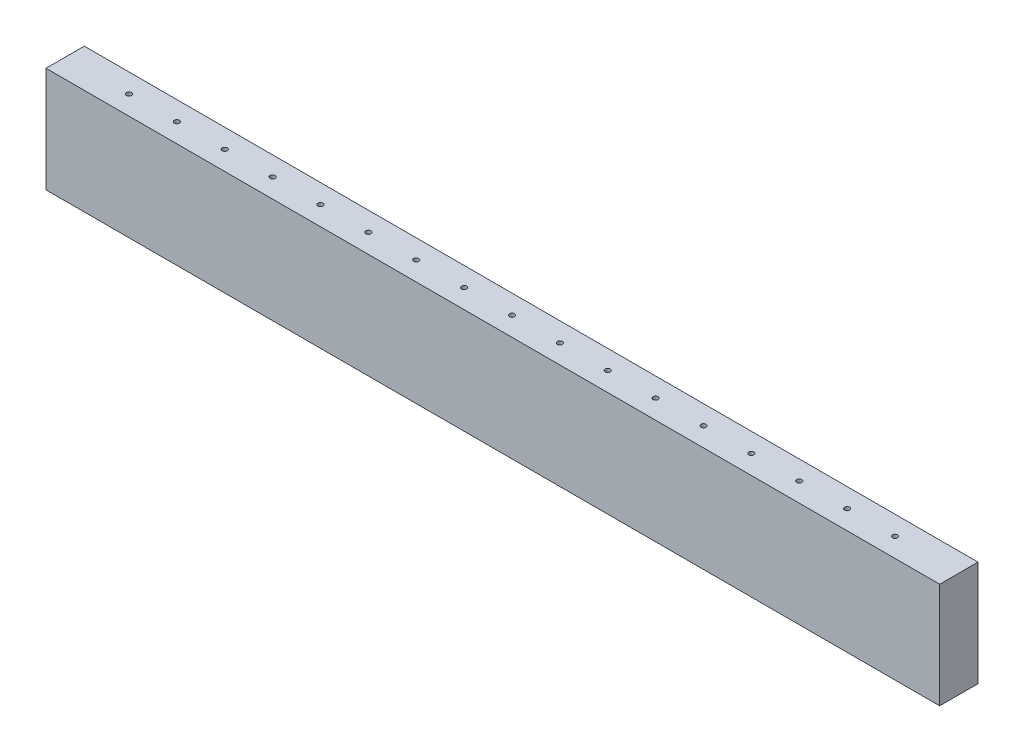
from build123d import *

# Parameters (mm, degrees)
SKETCH1_W             = 280
SKETCH1_H             = 12
BOSS_EXTRUDE1_DEPTH   = 33
LPATTERN1_COUNT       = 9
LPATTERN1_PITCH       = 15
LPATTERN1_COL_COUNT   = 9
LPATTERN1_COL_PITCH   = 15
M4_TAPPED_HOLE1_D     = 3.3
M4_TAPPED_HOLE1_DEPTH = 15
M4_TAPPED_HOLE1_TIP   = 0.991420021


with BuildPart() as part:
    # Sketch1 → Boss-Extrude1 (new body)
    with BuildSketch(Plane(origin=(0, 0, 0), x_dir=(1, 0, 0), z_dir=(0, 1, 0))):
        Rectangle(SKETCH1_W, SKETCH1_H)
    extrude(amount=BOSS_EXTRUDE1_DEPTH)

    # Sketch4 → M2 Tapped Hole1 (revolve, cut)
    with BuildSketch(Plane(origin=(0, 33, 0), x_dir=(0, 0, 1), z_dir=(1, 0, 0))):
        Polygon((0, 0), (0, 15.480688495), (0.8, 15), (0.8, 0), align=None)
    m2_tapped_hole1 = revolve(axis=Axis((0, 39.35, 0), (0, -1, 0)), mode=Mode.SUBTRACT)

    # LPattern1: M2 Tapped Hole1 ×9
    with Locations(*[(i * LPATTERN1_PITCH, 0, 0) for i in range(1, LPATTERN1_COUNT)]):
        add(m2_tapped_hole1, mode=Mode.SUBTRACT)

    # LPattern1 col: M2 Tapped Hole1 ×9
    with Locations(*[(-i * LPATTERN1_COL_PITCH, 0, 0) for i in range(1, LPATTERN1_COL_COUNT)]):
        add(m2_tapped_hole1, mode=Mode.SUBTRACT)

    # M4 Tapped Hole1
    with Locations(Plane(origin=(0, 0, 0), x_dir=(-1, 0, 0), z_dir=(0, -1, 0))):
        with Locations((-120, 0), (120, 0)):
            Hole(M4_TAPPED_HOLE1_D / 2, depth=M4_TAPPED_HOLE1_DEPTH)
            with Locations((0, 0, -(M4_TAPPED_HOLE1_DEPTH + M4_TAPPED_HOLE1_TIP / 2))):  # 118° drill point
                Cone(0, M4_TAPPED_HOLE1_D / 2, M4_TAPPED_HOLE1_TIP, mode=Mode.SUBTRACT)


solid = part.part
